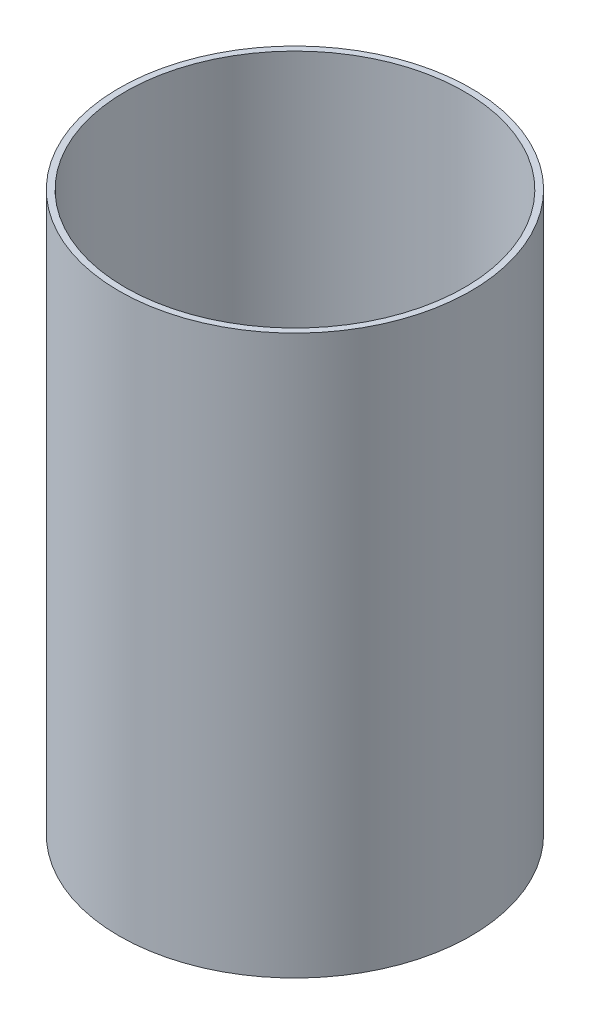
from build123d import *

# Parameters (mm, degrees)
SKETCH1_R           = 85
SKETCH1_R_2         = 82
BOSS_EXTRUDE1_DEPTH = 270


with BuildPart() as part:
    # Sketch1 → Boss-Extrude1 (new body)
    with BuildSketch(Plane(origin=(0, 0, 0), x_dir=(1, 0, 0), z_dir=(0, 1, 0))):
        with Locations(Location((0, 0, 0), (0, 0, 270))):
            Circle(SKETCH1_R)
        with Locations(Location((0, 0, 0), (0, 0, 270))):
            Circle(SKETCH1_R_2, mode=Mode.SUBTRACT)
    extrude(amount=BOSS_EXTRUDE1_DEPTH)


solid = part.part
